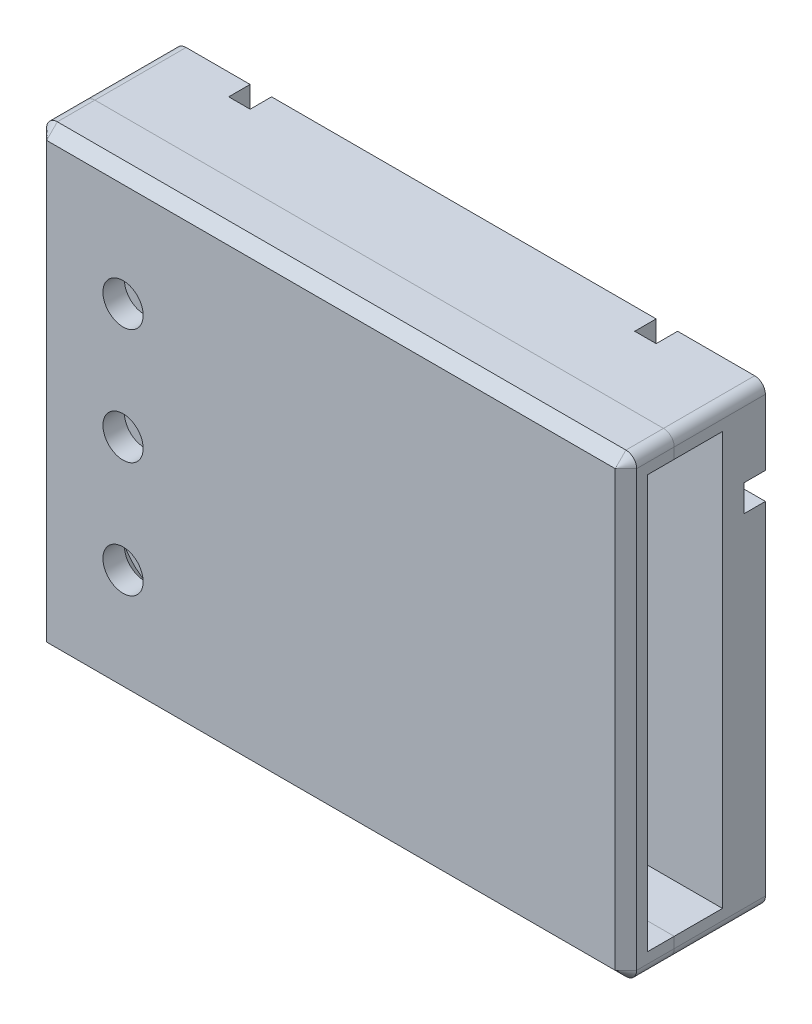
from build123d import *

# Parameters (mm, degrees)
SKETCH1_W           = 110
SKETCH1_H           = 85
BOSS_EXTRUDE1_DEPTH = 35
SHELL1_T            = -4
SKETCH2_R           = 3.75
CUT_EXTRUDE1_DEPTH  = 5
BOSS_EXTRUDE2_DEPTH = 22
SKETCH4_W           = 10
SKETCH4_H           = 16
CUT_EXTRUDE2_DEPTH  = 2
SKETCH5_W           = 1.8
SKETCH5_H           = 16
CUT_EXTRUDE3_DEPTH  = 2
SKETCH6_R           = 8
CUT_EXTRUDE8_DEPTH  = 6
SKETCH7_W           = 2.18
SKETCH7_H           = 4
SKETCH7_W_2         = 2.63
CUT_EXTRUDE9_DEPTH  = 2
SKETCH8_W           = 110
SKETCH8_H           = 85
CUT_EXTRUDE10_DEPTH = 17
SKETCH9_W           = 110
SKETCH9_H           = 85
BOSS_EXTRUDE4_DEPTH = 8
SKETCH10_R          = 4
CUT_EXTRUDE11_DEPTH = 10
SKETCH11_W          = 400
SKETCH11_H          = 5
CUT_EXTRUDE12_DEPTH = 4
SKETCH12_W          = 4
SKETCH12_H          = 400
CUT_EXTRUDE13_DEPTH = 4
CUT_EXTRUDE14_DEPTH = 4
SKETCH14_R          = 4
CUT_EXTRUDE15_DEPTH = 4
BOSS_EXTRUDE5_DEPTH = 4
FILLET1_R           = 2
CHAMFER1_SIZE       = 2


with BuildPart() as part:
    # Sketch1 → Boss-Extrude1 (new body)
    with BuildSketch(Plane.XY):
        with Locations((55, 42.5)):
            Rectangle(SKETCH1_W, SKETCH1_H)
    extrude(amount=BOSS_EXTRUDE1_DEPTH)

    # Shell1
    shell1_openings = [part.faces().sort_by_distance(p)[0] for p in [
        (110, 42.5, 17.5),
    ]]
    offset(amount=SHELL1_T, openings=shell1_openings, kind=Kind.INTERSECTION)

    # Sketch2 → Cut-Extrude1 (cut)
    with BuildSketch(Plane.XY.offset(35)):
        with Locations((16.25, 63.75)):
            Circle(SKETCH2_R)
        with Locations((16.25, 42.25)):
            Circle(SKETCH2_R)
        with Locations((16.25, 20.75)):
            Circle(SKETCH2_R)
    extrude(amount=-CUT_EXTRUDE1_DEPTH, mode=Mode.SUBTRACT)

    # Sketch3 → Boss-Extrude2 (add)
    with BuildSketch(Plane.XY.offset(4)):
        with BuildLine():
            Line((6.25, 63.75), (6.25, 59.058875489))
            ThreePointArc((6.25, 59.058875489), (6.718704627, 57.309233136), (7.99928478, 56.028199621))
            ThreePointArc((7.99928478, 56.028199621), (9.747140287, 53), (7.99928478, 49.971800379))
            ThreePointArc((7.99928478, 49.971800379), (6.718704627, 48.690766864), (6.25, 46.941124511))
            Line((6.25, 46.941124511), (6.25, 38.058875489))
            ThreePointArc((6.25, 38.058875489), (6.718704627, 36.309233136), (7.99928478, 35.028199621))
            ThreePointArc((7.99928478, 35.028199621), (9.747140287, 32), (7.99928478, 28.971800379))
            ThreePointArc((7.99928478, 28.971800379), (6.718704627, 27.690766864), (6.25, 25.941124511))
            Line((6.25, 25.941124511), (6.25, 20.75))
            ThreePointArc((6.25, 20.75), (9.178932188, 13.678932188), (16.25, 10.75))
            Line((16.25, 10.75), (24.25, 10.75))
            ThreePointArc((24.25, 10.75), (25.664213562, 11.335786438), (26.25, 12.75))
            Line((26.25, 12.75), (26.25, 20.75))
            Line((26.25, 20.75), (26.25, 63.75))
            Line((26.25, 63.75), (26.25, 71.75))
            ThreePointArc((26.25, 71.75), (25.664213562, 73.164213562), (24.25, 73.75))
            Line((24.25, 73.75), (16.25, 73.75))
            ThreePointArc((16.25, 73.75), (9.178932188, 70.821067812), (6.25, 63.75))
        make_face()
    extrude(amount=BOSS_EXTRUDE2_DEPTH)

    # Sketch4 → Cut-Extrude2 (cut)
    with BuildSketch(Plane.XY.offset(26)):
        with Locations((21.25, 63.75)):
            Rectangle(SKETCH4_W, SKETCH4_H)
        with BuildLine():
            Line((16.25, 71.75), (16.25, 55.75))
            ThreePointArc((16.25, 55.75), (8.25, 63.75), (16.25, 71.75))
        make_face()
        with BuildLine():
            Line((26.25, 34.25), (26.25, 50.25))
            Line((26.25, 50.25), (16.25, 50.25))
            ThreePointArc((16.25, 50.25), (8.25, 42.25), (16.25, 34.25))
            Line((16.25, 34.25), (26.25, 34.25))
        make_face()
        with BuildLine():
            Line((26.25, 12.75), (26.25, 28.75))
            Line((26.25, 28.75), (16.25, 28.75))
            ThreePointArc((16.25, 28.75), (8.25, 20.75), (16.25, 12.75))
            Line((16.25, 12.75), (26.25, 12.75))
        make_face()
    extrude(amount=-CUT_EXTRUDE2_DEPTH, mode=Mode.SUBTRACT)

    # Sketch5 → Cut-Extrude3 (cut)
    with BuildSketch(Plane.XY.offset(24)):
        with Locations((25.35, 63.75)):
            Rectangle(SKETCH5_W, SKETCH5_H)
        with Locations((25.35, 42.25)):
            Rectangle(SKETCH5_W, SKETCH5_H)
        with Locations((25.35, 20.75)):
            Rectangle(SKETCH5_W, SKETCH5_H)
    extrude(amount=-CUT_EXTRUDE3_DEPTH, mode=Mode.SUBTRACT)

    # Sketch6 → Cut-Extrude8 (cut)
    with BuildSketch(Plane.XY.offset(24)):
        with Locations((16.25, 63.75)):
            Circle(SKETCH6_R)
        with Locations((16.25, 42.25)):
            Circle(SKETCH6_R)
        with Locations((16.25, 20.75)):
            Circle(SKETCH6_R)
    extrude(amount=-CUT_EXTRUDE8_DEPTH, mode=Mode.SUBTRACT)

    # Sketch7 → Cut-Extrude9 (cut)
    with BuildSketch(Plane.XY.offset(24)):
        with Locations((24.45, 63.75)):
            Rectangle(SKETCH7_W, SKETCH7_H)
        with Locations((24.45, 42.25)):
            Rectangle(SKETCH7_W, SKETCH7_H)
        with Locations((24.45, 20.75)):
            Rectangle(SKETCH7_W_2, SKETCH7_H)
    extrude(amount=-CUT_EXTRUDE9_DEPTH, mode=Mode.SUBTRACT)

    # Sketch8 → Cut-Extrude10 (cut)
    with BuildSketch(Plane(origin=(0, 0, 0), x_dir=(-1, 0, 0), z_dir=(0, 0, -1))):
        with Locations((-55, 42.5)):
            Rectangle(SKETCH8_W, SKETCH8_H)
    extrude(amount=-CUT_EXTRUDE10_DEPTH, mode=Mode.SUBTRACT)


with BuildPart() as cut_extrude10_piece_1:
    # of the separate pieces the step leaves, piece 1, a body of its own (cut_extrude10_pieces)
    add(part.part.solids().sort_by_distance((0, 85, 17))[0])



with BuildPart() as cut_extrude10_piece_2:
    # of the separate pieces the step leaves, piece 2, a body of its own (cut_extrude10_pieces)
    add(part.part.solids().sort_by_distance((6.25, 59.058875489, 17))[0])


with BuildPart() as cut_extrude10_piece_1_1:
    add(cut_extrude10_piece_1.part)

    add(cut_extrude10_piece_2.part)  # Boss-Extrude4 merges Cut-Extrude10 piece 2
    # Sketch9 → Boss-Extrude4 (add)
    with BuildSketch(Plane(origin=(0, 0, 17), x_dir=(-1, 0, 0), z_dir=(0, 0, -1))):
        with Locations((-55, 42.5)):
            Rectangle(SKETCH9_W, SKETCH9_H)
    extrude(amount=BOSS_EXTRUDE4_DEPTH)

    # Sketch10 → Cut-Extrude11 (cut)
    with BuildSketch(Plane(origin=(0, 0, 9), x_dir=(-1, 0, 0), z_dir=(0, 0, -1))):
        with Locations((-91.635892751, 68.213390564)):
            Circle(SKETCH10_R)
    extrude(amount=-CUT_EXTRUDE11_DEPTH, mode=Mode.SUBTRACT)

    # Sketch11 → Cut-Extrude12 (cut)
    with BuildSketch(Plane(origin=(0, 0, 9), x_dir=(-1, 0, 0), z_dir=(0, 0, -1))):
        with Locations((-95.635892751, 68.213390564)):
            Rectangle(SKETCH11_W, SKETCH11_H)
    extrude(amount=-CUT_EXTRUDE12_DEPTH, mode=Mode.SUBTRACT)

    # Sketch12 → Cut-Extrude13 (cut)
    with BuildSketch(Plane(origin=(0, 0, 9), x_dir=(-1, 0, 0), z_dir=(0, 0, -1))):
        with Locations((-91.635892751, 68.213390564)):
            Rectangle(SKETCH12_W, SKETCH12_H)
    extrude(amount=-CUT_EXTRUDE13_DEPTH, mode=Mode.SUBTRACT)

    # Sketch13 → Cut-Extrude14 (cut)
    with BuildSketch(Plane(origin=(0, 0, 9), x_dir=(-1, 0, 0), z_dir=(0, 0, -1))):
        with BuildLine():
            Line((-89.635892751, 65.95101575), (-89.635892751, 64.99515496))
            Line((-89.635892751, 64.99515496), (-30.944122707, 17.060929682))
            ThreePointArc((-30.944122707, 17.060929682), (-29.734157956, 12.544767786), (-25.067320954, 12.261279936))
            Line((-25.067320954, 12.261279936), (-20.330852628, 8.392953259))
            Line((-20.330852628, 8.392953259), (-20.330852628, 0))
            Line((-20.330852628, 0), (-16.330852628, 0))
            Line((-16.330852628, 0), (-16.330852628, 9.355434762))
            ThreePointArc((-16.330852628, 9.355434762), (-16.289752238, 10.106874078), (-16.79203771, 10.667284278))
            Line((-16.79203771, 10.667284278), (-23.325201079, 16.002991899))
            Line((-23.325201079, 16.002991899), (-23.566707085, 16.498941734))
            ThreePointArc((-23.566707085, 16.498941734), (-23.617102691, 16.645193724), (-23.630882747, 16.799269911))
            ThreePointArc((-23.630882747, 16.799269911), (-23.622128276, 16.886117691), (-23.601621561, 16.970962564))
            Line((-23.601621561, 16.970962564), (-15.294561061, 65.713390564))
            Line((-15.294561061, 65.713390564), (-19.352236465, 65.713390564))
            Line((-19.352236465, 65.713390564), (-27.203936928, 19.64282872))
            ThreePointArc((-27.203936928, 19.64282872), (-27.463571803, 19.514302093), (-27.738043433, 19.607009624))
            Line((-27.738043433, 19.607009624), (-84.191758748, 65.713390564))
            Line((-84.191758748, 65.713390564), (-88.513393752, 65.713390564))
            Line((-88.513393752, 65.713390564), (-89.635892751, 65.95101575))
        make_face()
        with BuildLine():
            Line((-13.940150026, 70.713390564), (-13.940150026, 85))
            Line((-13.940150026, 85), (-17.940150026, 85))
            Line((-17.940150026, 85), (-17.940150026, 72.894621715))
            ThreePointArc((-17.940150026, 72.894621715), (-18.323984529, 71.59541451), (-19.352236465, 70.713390564))
            Line((-19.352236465, 70.713390564), (-17.940150026, 70.713390564))
            Line((-17.940150026, 70.713390564), (-13.940150026, 70.713390564))
        make_face()
    extrude(amount=-CUT_EXTRUDE14_DEPTH, mode=Mode.SUBTRACT)

    # Sketch14 → Cut-Extrude15 (cut)
    with BuildSketch(Plane(origin=(0, 0, 13), x_dir=(-1, 0, 0), z_dir=(0, 0, -1))):
        with Locations(Location((-27.203936928, 15.64282872, 0), (0, 0, 3.848774787))):
            Circle(SKETCH14_R)
    extrude(amount=-CUT_EXTRUDE15_DEPTH, mode=Mode.SUBTRACT)

    # Sketch15 → Boss-Extrude5 (add)
    with BuildSketch(Plane(origin=(0, 0, 17), x_dir=(-1, 0, 0), z_dir=(0, 0, -1))):
        with BuildLine():
            Line((-26.25, 19.527414198), (-26.25, 12.75))
            ThreePointArc((-26.25, 12.75), (-26.192025516, 12.271944671), (-26.021463103, 11.821604354))
            ThreePointArc((-26.021463103, 11.821604354), (-23.205694932, 15.761407537), (-26.25, 19.527414198))
        make_face()
    extrude(amount=BOSS_EXTRUDE5_DEPTH)

    # Fillet1
    fillet1_edges = [cut_extrude10_piece_1_1.edges().sort_by_distance(p)[0] for p in [
        (0, 85, 22),
        (110, 85, 22),
        (110, 0, 22),
        (0, 0, 22),
    ]]
    fillet(fillet1_edges, radius=FILLET1_R)

    # Chamfer1
    chamfer1_edges = [cut_extrude10_piece_1_1.edges().sort_by_distance(p)[0] for p in [
        (0, 42.5, 35),
        (55, 85, 35),
        (55, 0, 35),
        (110, 42.5, 35),
        (109.414213562, 84.414213562, 35),
        (109.414213562, 0.585786438, 35),
        (0.585786438, 0.585786438, 35),
        (0.585786438, 84.414213562, 35),
    ]]
    chamfer(chamfer1_edges, length=CHAMFER1_SIZE)


with BuildPart() as body_2:
    # Split1: the piece on the far side of the plane
    add(cut_extrude10_piece_1_1.part)
    split(bisect_by=Plane.XY.offset(26), keep=Keep.BOTTOM)


with BuildPart() as cut_extrude10_piece_1_2:
    add(cut_extrude10_piece_1_1.part)

    # Split1
    split(bisect_by=Plane.XY.offset(26), keep=Keep.TOP)


solid = Compound([body_2.part, cut_extrude10_piece_1_2.part])
